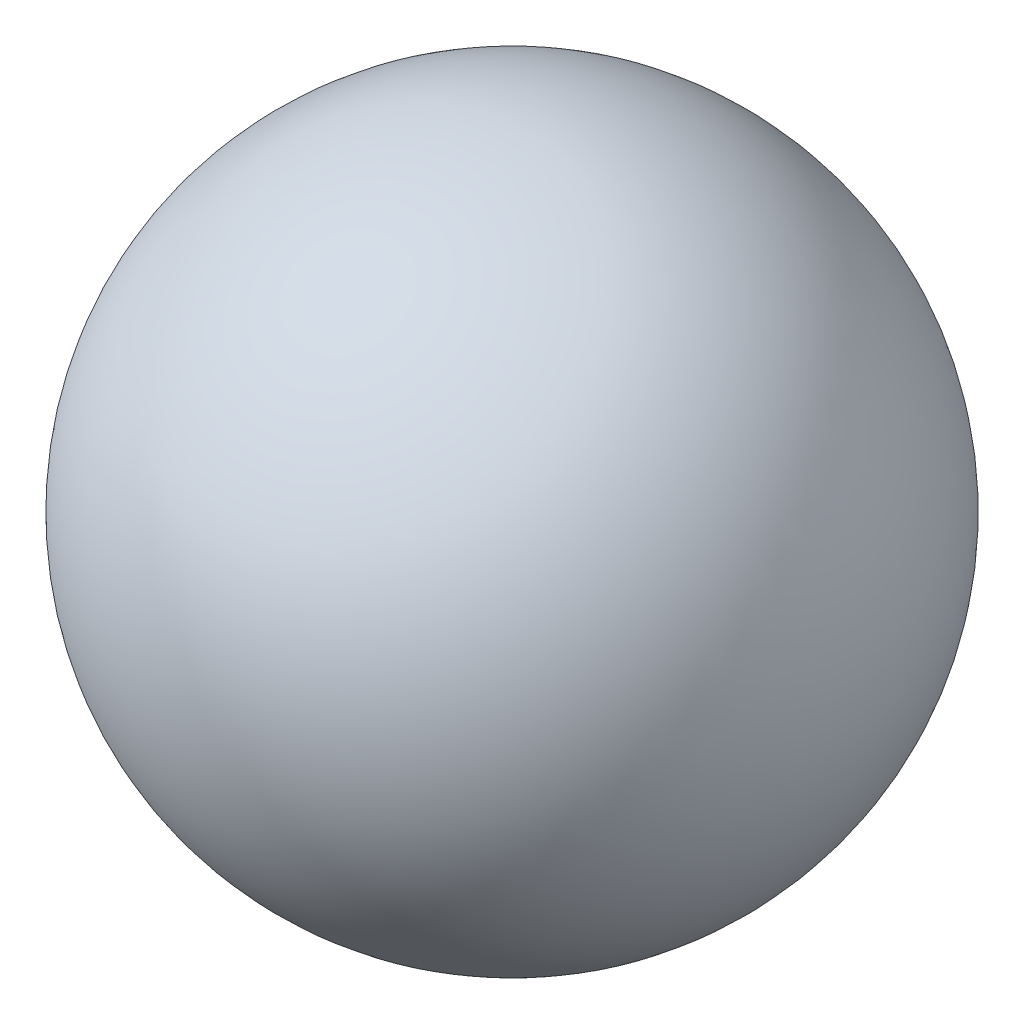
from build123d import *


with BuildPart() as part:
    # Sketch1 → Revolve5 (revolve)
    with BuildSketch(Plane.XY):
        with BuildLine():
            Line((0, 21.31), (0, -21.31))
            ThreePointArc((0, -21.31), (21.31, 0), (0, 21.31))
        make_face()
    revolve(axis=Axis((0, 21.31, 0), (0, -1, 0)))


solid = part.part
